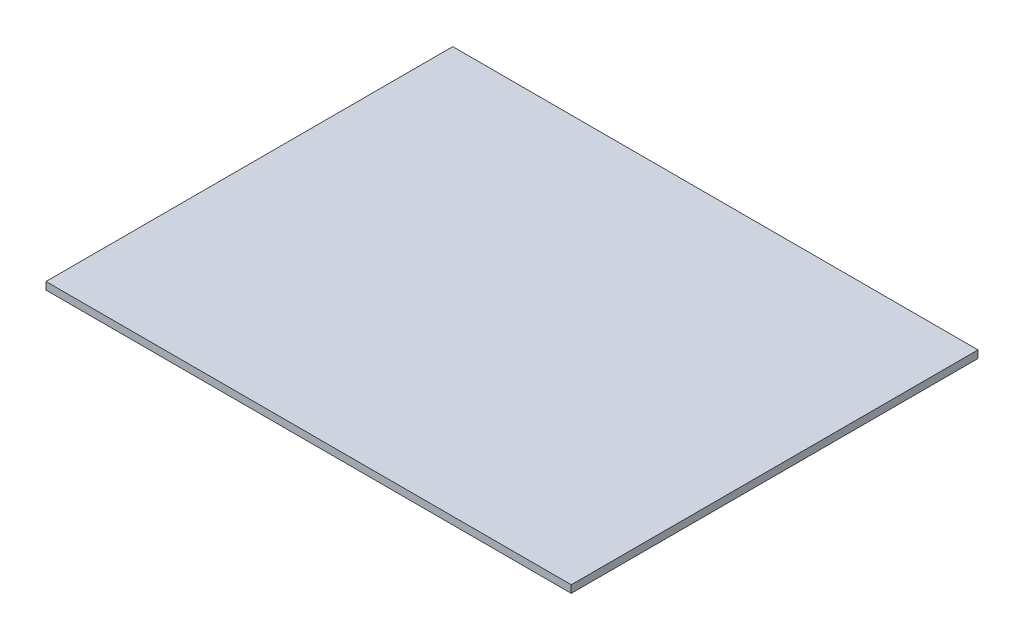
from build123d import *

# Parameters (mm, degrees)
SKETCH1_W           = 1544
SKETCH1_H           = 1195.666666666
BOSS_EXTRUDE1_DEPTH = 22


with BuildPart() as part:
    # Sketch1 → Boss-Extrude1 (new body)
    with BuildSketch(Plane(origin=(0, 0, 0), x_dir=(1, 0, 0), z_dir=(0, 1, 0))):
        Rectangle(SKETCH1_W, SKETCH1_H)
    extrude(amount=BOSS_EXTRUDE1_DEPTH)


solid = part.part
